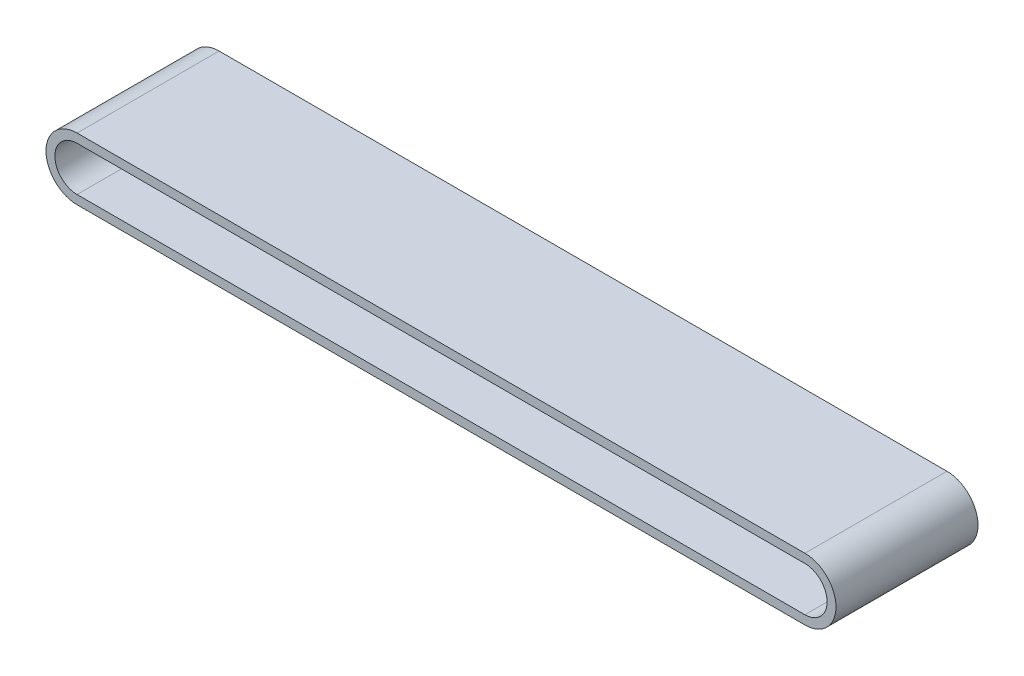
from build123d import *

# Parameters (mm, degrees)
BOSS_EXTRUDE1_DEPTH = 80


with BuildPart() as part:
    # Sketch1 → Boss-Extrude1 (new body)
    with BuildSketch(Plane.XY):
        with BuildLine():
            Line((-244.768384079, -10.761779925), (165.449051275, -10.760429069))
            ThreePointArc((165.449051275, -10.760429069), (182.731278203, 6.84693985), (165.231615921, 24.238220075))
            Line((165.231615921, 24.238220075), (-244.768384079, 24.238220075))
            ThreePointArc((-244.768384079, 24.238220075), (-262.268384079, 6.738220075), (-244.768384079, -10.761779925))
        make_face()
        with BuildLine():
            ThreePointArc((165.231615921, -5.761779925), (177.731615921, 6.738220075), (165.231615921, 19.238220075))
            Line((165.231615921, 19.238220075), (-244.768384079, 19.238220075))
            ThreePointArc((-244.768384079, 19.238220075), (-257.268384079, 6.738220075), (-244.768384079, -5.761779925))
            Line((-244.768384079, -5.761779925), (165.231615921, -5.761779925))
        make_face(mode=Mode.SUBTRACT)
    extrude(amount=BOSS_EXTRUDE1_DEPTH)


solid = part.part
